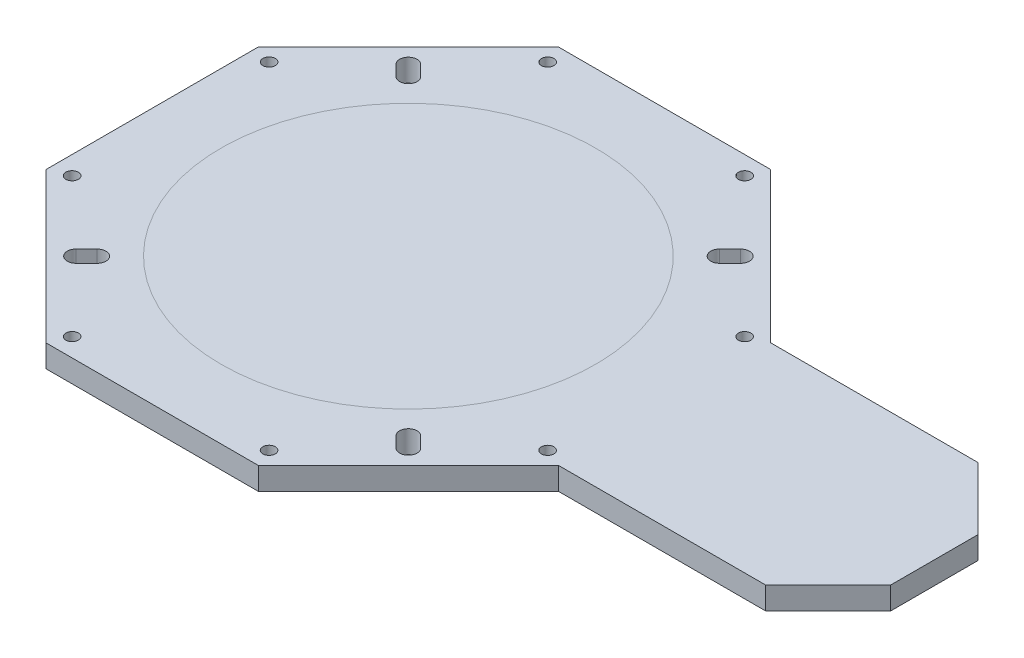
from build123d import *

# Parameters (mm, degrees)
SKETCH1_R           = 2.5
BOSS_EXTRUDE1_DEPTH = 9


with BuildPart() as part:
    # Sketch1 → Boss-Extrude1 (new body)
    # profile 1 of 2: a face of its own
    with BuildSketch(Plane(origin=(0, 0, 0), x_dir=(1, 0, 0), z_dir=(0, 1, 0))):
        Polygon((42.5, 102.604076401), (-42.5, 102.604076401), (-102.604076401, 42.5), (-102.604076401, -42.5), (-42.5, -102.604076401), (42.5, -102.604076401), (102.604076401, -42.5), (102.604076401, 42.5), align=None)
        with Locations(Location((-39.448264129, -95.209016687, 0), (0, 0, 270))):
            Circle(SKETCH1_R, mode=Mode.SUBTRACT)
        with BuildLine():
            Line((-59.824116139, -64.773863607), (-64.066756826, -69.016504294))
            ThreePointArc((-64.066756826, -69.016504294), (-69.016504294, -69.016504294), (-69.016504294, -64.066756826))
            Line((-69.016504294, -64.066756826), (-64.773863607, -59.824116139))
            ThreePointArc((-64.773863607, -59.824116139), (-60.95959786, -59.065411509), (-58.798989873, -62.298989873))
            ThreePointArc((-58.798989873, -62.298989873), (-59.065411509, -63.638381887), (-59.824116139, -64.773863607))
        make_face(mode=Mode.SUBTRACT)
        with Locations(Location((39.428806258, -95.217076401, 0), (0, 0, 270))):
            Circle(SKETCH1_R, mode=Mode.SUBTRACT)
        with Locations(Location((-95.217076401, -39.428806258, 0), (0, 0, 270))):
            Circle(SKETCH1_R, mode=Mode.SUBTRACT)
        with BuildLine():
            Line((64.773863607, -59.824116139), (69.016504294, -64.066756826))
            ThreePointArc((69.016504294, -64.066756826), (69.775208924, -65.202238547), (70.04163056, -66.54163056))
            ThreePointArc((70.04163056, -66.54163056), (67.881022574, -69.775208924), (64.066756826, -69.016504294))
            Line((64.066756826, -69.016504294), (59.824116139, -64.773863607))
            ThreePointArc((59.824116139, -64.773863607), (59.824116139, -59.824116139), (64.773863607, -59.824116139))
        make_face(mode=Mode.SUBTRACT)
        with Locations(Location((95.209016687, -39.448264129, 0), (0, 0, 270))):
            Circle(SKETCH1_R, mode=Mode.SUBTRACT)
        with Locations(Location((-95.209016687, 39.448264129, 0), (0, 0, 270))):
            Circle(SKETCH1_R, mode=Mode.SUBTRACT)
        with BuildLine():
            Line((-64.773863607, 59.824116139), (-69.016504294, 64.066756826))
            ThreePointArc((-69.016504294, 64.066756826), (-69.016504294, 69.016504294), (-64.066756826, 69.016504294))
            Line((-64.066756826, 69.016504294), (-59.824116139, 64.773863607))
            ThreePointArc((-59.824116139, 64.773863607), (-59.065411509, 63.638381887), (-58.798989873, 62.298989873))
            ThreePointArc((-58.798989873, 62.298989873), (-60.95959786, 59.065411509), (-64.773863607, 59.824116139))
        make_face(mode=Mode.SUBTRACT)
        with Locations(Location((-39.428806258, 95.217076401, 0), (0, 0, 270))):
            Circle(SKETCH1_R, mode=Mode.SUBTRACT)
        with Locations(Location((39.448264129, 95.209016687, 0), (0, 0, 270))):
            Circle(SKETCH1_R, mode=Mode.SUBTRACT)
        with Locations(Location((95.217076401, 39.428806258, 0), (0, 0, 270))):
            Circle(SKETCH1_R, mode=Mode.SUBTRACT)
        with BuildLine():
            Line((59.824116139, 64.773863607), (64.066756826, 69.016504294))
            ThreePointArc((64.066756826, 69.016504294), (67.881022574, 69.775208924), (70.04163056, 66.54163056))
            ThreePointArc((70.04163056, 66.54163056), (69.775208924, 65.202238547), (69.016504294, 64.066756826))
            Line((69.016504294, 64.066756826), (64.773863607, 59.824116139))
            ThreePointArc((64.773863607, 59.824116139), (59.824116139, 59.824116139), (59.824116139, 64.773863607))
        make_face(mode=Mode.SUBTRACT)
    # profile 2 of 2: a face of its own
    with BuildSketch(Plane(origin=(0, 0, 0), x_dir=(1, 0, 0), z_dir=(0, 1, 0))):
        Polygon((102.604076401, -42.5), (185.604076401, -42.5), (210.604076401, -17.5), (210.604076401, 17.5), (185.604076401, 42.5), (102.604076401, 42.5), align=None)
    extrude(amount=BOSS_EXTRUDE1_DEPTH)


solid = part.part
